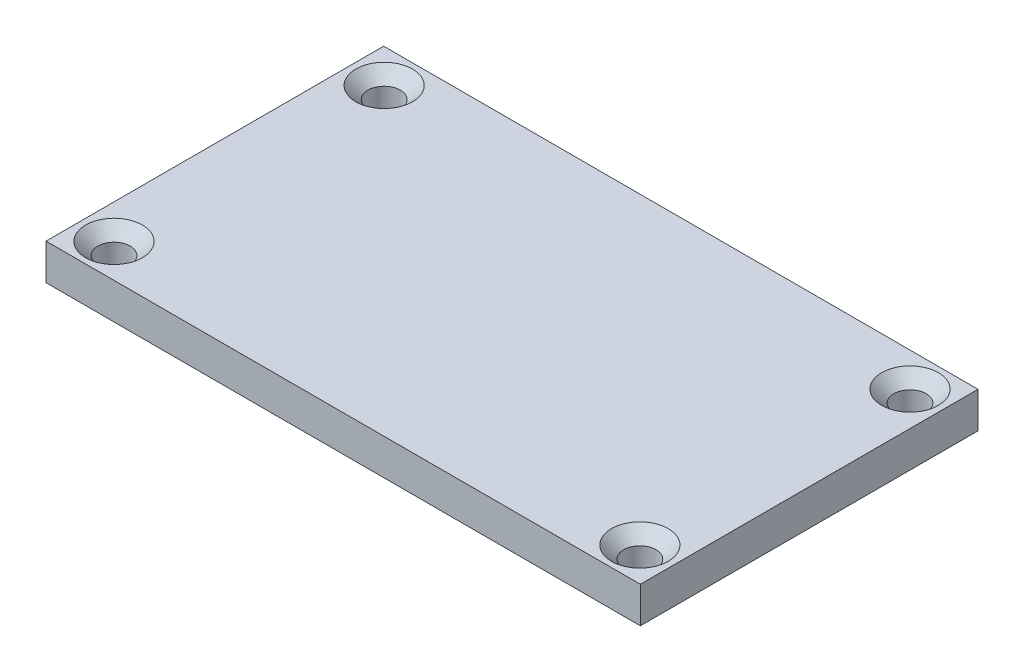
from build123d import *

# Parameters (mm, degrees)
SKETCH1_W                                           = 66
SKETCH1_H                                           = 37.5
BOSS_EXTRUDE1_DEPTH                                 = 2
CSK_FOR_M3_COUNTERSUNK_FLAT_HEAD_SCREW1_D           = 3.6
CSK_FOR_M3_COUNTERSUNK_FLAT_HEAD_SCREW1_DEPTH       = 5
CSK_FOR_M3_COUNTERSUNK_FLAT_HEAD_SCREW1_CSINK_D     = 6.3
CSK_FOR_M3_COUNTERSUNK_FLAT_HEAD_SCREW1_CSINK_ANGLE = 90
CSK_FOR_M3_COUNTERSUNK_FLAT_HEAD_SCREW1_TIP         = 1.081549114


with BuildPart() as part:
    # Sketch1 → Boss-Extrude1 (new, symmetric)
    with BuildSketch(Plane(origin=(0, 0, 0), x_dir=(1, 0, 0), z_dir=(0, 1, 0))):
        Rectangle(SKETCH1_W, SKETCH1_H)
    extrude(amount=BOSS_EXTRUDE1_DEPTH, both=True)

    # CSK for M3 Countersunk Flat Head Screw1
    with Locations(Plane(origin=(0, 2, 0), x_dir=(1, 0, 0), z_dir=(0, 1, 0))):
        with Locations((-29.2, -15), (-29.2, 15), (29.2, 15), (29.2, -15)):
            CounterSinkHole(CSK_FOR_M3_COUNTERSUNK_FLAT_HEAD_SCREW1_D / 2, CSK_FOR_M3_COUNTERSUNK_FLAT_HEAD_SCREW1_CSINK_D / 2, depth=CSK_FOR_M3_COUNTERSUNK_FLAT_HEAD_SCREW1_DEPTH, counter_sink_angle=CSK_FOR_M3_COUNTERSUNK_FLAT_HEAD_SCREW1_CSINK_ANGLE)
            with Locations((0, 0, -(CSK_FOR_M3_COUNTERSUNK_FLAT_HEAD_SCREW1_DEPTH + CSK_FOR_M3_COUNTERSUNK_FLAT_HEAD_SCREW1_TIP / 2))):  # 118° drill point
                Cone(0, CSK_FOR_M3_COUNTERSUNK_FLAT_HEAD_SCREW1_D / 2, CSK_FOR_M3_COUNTERSUNK_FLAT_HEAD_SCREW1_TIP, mode=Mode.SUBTRACT)


solid = part.part
